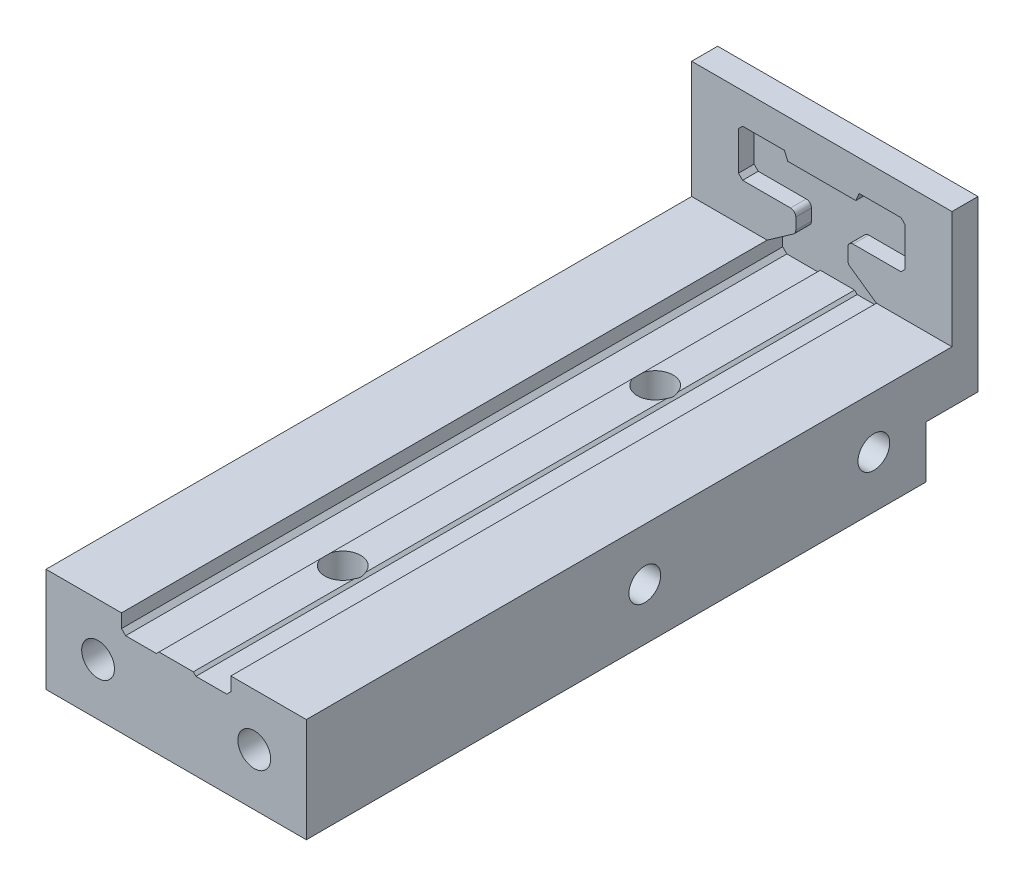
from build123d import *

# Parameters (mm, degrees)
SKETCH1_W           = 50
SKETCH1_H           = 20
BOSS_EXTRUDE1_DEPTH = 124
CUT_EXTRUDE1_REACH  = 128.89
SKETCH4_W           = 50
SKETCH4_H           = 42.5
BOSS_EXTRUDE2_DEPTH = 5
CUT_EXTRUDE2_DEPTH  = 3
SKETCH6_R           = 3.45
CUT_EXTRUDE3_DEPTH  = 134.834494571
SKETCH7_W           = 10
SKETCH7_H           = 10
CUT_EXTRUDE4_DEPTH  = 143.11702924
SKETCH8_R           = 3.05
CUT_EXTRUDE5_DEPTH  = 5
SKETCH9_R           = 3.15
CUT_EXTRUDE6_DEPTH  = 5


with BuildPart() as part:
    # Sketch1 → Boss-Extrude1 (new body)
    with BuildSketch(Plane.XY):
        Rectangle(SKETCH1_W, SKETCH1_H)
    extrude(amount=-BOSS_EXTRUDE1_DEPTH)

    # Sketch2 → Cut-Extrude1 (cut, up to next)
    with BuildSketch(Plane.XY, mode=Mode.PRIVATE) as cut_extrude1_sk1:
        Polygon((-10.499848989, 10.238924494), (0, 10.238924494), (10.499848989, 10.238924494), (10.499848989, 7.382817713), (9.707031275, 6.59), (3.792817713, 6.59), (3.292893219, 7.089924494), (-3.292893219, 7.089924494), (-3.792817713, 6.59), (-9.707031275, 6.59), (-10.499848989, 7.382817713), align=None)
    cut_extrude1_tool1 = extrude(cut_extrude1_sk1.sketch, amount=-CUT_EXTRUDE1_REACH, mode=Mode.PRIVATE) & part.part
    add(cut_extrude1_tool1.solids().sort_by_distance((0, 8.505261, 0))[0], mode=Mode.SUBTRACT)

    # Sketch4 → Boss-Extrude2 (add)
    with BuildSketch(Plane(origin=(0, 0, -124), x_dir=(-1, 0, 0), z_dir=(0, 0, -1))):
        with Locations((0, 11.25)):
            Rectangle(SKETCH4_W, SKETCH4_H)
    extrude(amount=BOSS_EXTRUDE2_DEPTH)

    # Sketch5 → Cut-Extrude2 (cut)
    with BuildSketch(Plane.XY.offset(-124)):
        with BuildLine():
            Line((-3.292893219, 7.089924494), (3.292893219, 7.089924494))
            Line((3.292893219, 7.089924494), (3.792817713, 6.59))
            Line((3.792817713, 6.59), (9.707031275, 6.59))
            Line((9.707031275, 6.59), (10.499848989, 7.382817713))
            Line((10.499848989, 7.382817713), (10.499848989, 9.99920802))
            Line((10.499848989, 9.99920802), (5.426401458, 13.551674225))
            ThreePointArc((5.426401458, 13.551674225), (5.112967061, 13.909077656), (4.999977894, 14.37082627))
            Line((4.999977894, 14.37082627), (4.999977894, 16.58982627))
            ThreePointArc((4.999977894, 16.58982627), (5.292871113, 17.296933051), (5.999977894, 17.58982627))
            Line((5.999977894, 17.58982627), (15.207084675, 17.58982627))
            Line((15.207084675, 17.58982627), (15.999902388, 18.382643983))
            Line((15.999902388, 18.382643983), (15.999902388, 25.796857545))
            Line((15.999902388, 25.796857545), (15.207084675, 26.589675258))
            Line((15.207084675, 26.589675258), (7.165888575, 26.589675258))
            Line((7.165888575, 26.589675258), (6.544410681, 25.089294897))
            Line((6.544410681, 25.089294897), (-6.544410681, 25.089294897))
            Line((-6.544410681, 25.089294897), (-7.165888575, 26.589675258))
            Line((-7.165888575, 26.589675258), (-15.207084675, 26.589675258))
            Line((-15.207084675, 26.589675258), (-15.999902388, 25.796857545))
            Line((-15.999902388, 25.796857545), (-15.999902388, 18.382643983))
            Line((-15.999902388, 18.382643983), (-15.207084675, 17.58982627))
            Line((-15.207084675, 17.58982627), (-5.999977894, 17.58982627))
            ThreePointArc((-5.999977894, 17.58982627), (-5.292871113, 17.296933051), (-4.999977894, 16.58982627))
            Line((-4.999977894, 16.58982627), (-4.999977894, 14.37082627))
            ThreePointArc((-4.999977894, 14.37082627), (-5.112967061, 13.909077656), (-5.426401458, 13.551674225))
            Line((-5.426401458, 13.551674225), (-10.499848989, 9.99920802))
            Line((-10.499848989, 9.99920802), (-10.499848989, 7.382817713))
            Line((-10.499848989, 7.382817713), (-9.707031275, 6.59))
            Line((-9.707031275, 6.59), (-3.792817713, 6.59))
            Line((-3.792817713, 6.59), (-3.292893219, 7.089924494))
        make_face()
    extrude(amount=-CUT_EXTRUDE2_DEPTH, mode=Mode.SUBTRACT)

    # Sketch6 → Cut-Extrude3 (cut, through all)
    with BuildSketch(Plane(origin=(0, 7.089924494, 0), x_dir=(1, 0, 0), z_dir=(0, 1, 0))):
        with Locations(Location((0, 92, 0), (0, 0, 270))):
            Circle(SKETCH6_R)
        with Locations(Location((0, 32, 0), (0, 0, 270))):
            Circle(SKETCH6_R)
    extrude(amount=-CUT_EXTRUDE3_DEPTH, mode=Mode.SUBTRACT)

    # Sketch7 → Cut-Extrude4 (cut, through all)
    with BuildSketch(Plane(origin=(25, 0, 0), x_dir=(0, 0, -1), z_dir=(1, 0, 0))):
        with Locations((124, -5)):
            Rectangle(SKETCH7_W, SKETCH7_H)
    extrude(amount=-CUT_EXTRUDE4_DEPTH, mode=Mode.SUBTRACT)

    # Sketch8 → Cut-Extrude5 (cut)
    with BuildSketch(Plane(origin=(25, 0, 0), x_dir=(0, 0, -1), z_dir=(1, 0, 0))):
        with Locations(Location((109, 0, 0), (0, 0, 90))):
            Circle(SKETCH8_R)
        with Locations(Location((65, 0, 0), (0, 0, 90))):
            Circle(SKETCH8_R)
    cut_extrude5 = extrude(amount=-CUT_EXTRUDE5_DEPTH, mode=Mode.SUBTRACT)

    # Mirror1: Cut-Extrude5 across plane
    add(cut_extrude5.mirror(Plane(origin=(0, 0, 0), x_dir=(0, 0, 1), z_dir=(1, 0, 0))), mode=Mode.SUBTRACT)

    # Sketch9 → Cut-Extrude6 (cut)
    with BuildSketch(Plane.XY):
        with Locations((-15, 0)):
            Circle(SKETCH9_R)
        with Locations((15, 0)):
            Circle(SKETCH9_R)
    extrude(amount=-CUT_EXTRUDE6_DEPTH, mode=Mode.SUBTRACT)


solid = part.part
